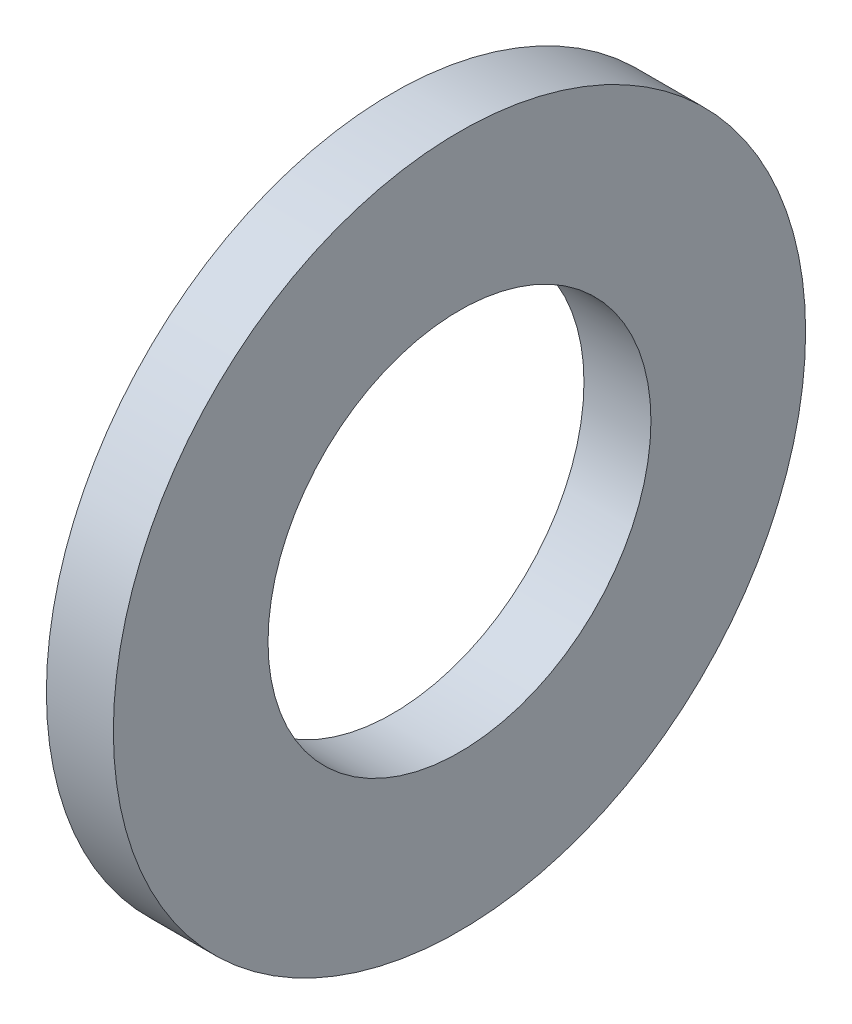
from build123d import *

# Parameters (mm, degrees)
SKETCH1_R           = 9.3218
SKETCH1_R_2         = 5.1562
BOSS_EXTRUDE1_DEPTH = 1.8034


with BuildPart() as part:
    # Sketch1 → Boss-Extrude1 (new body)
    with BuildSketch(Plane(origin=(0, 0, 0), x_dir=(0, 0, -1), z_dir=(1, 0, 0))):
        Circle(SKETCH1_R)
        Circle(SKETCH1_R_2, mode=Mode.SUBTRACT)
    extrude(amount=BOSS_EXTRUDE1_DEPTH)


solid = part.part
